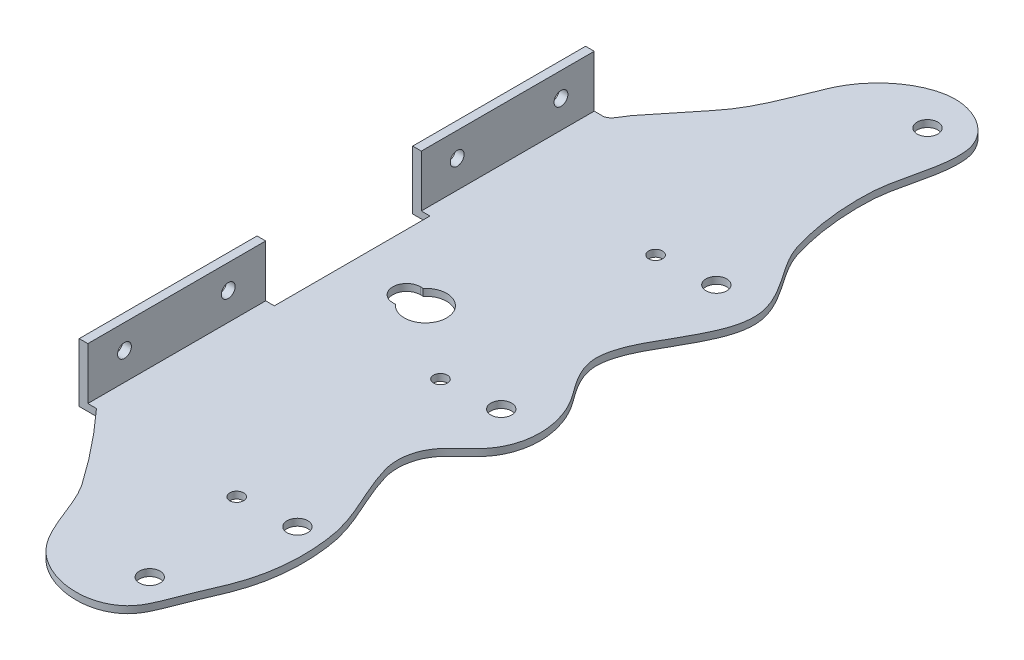
from build123d import *

# Parameters (mm, degrees)
SALIENTE_EXTRUIR1_DEPTH           = 2
CROQUIS2_W                        = 50
CROQUIS2_H                        = 2
SALIENTE_EXTRUIR2_DEPTH           = 5.004813031
CROQUIS3_W                        = 2.502406515
CROQUIS3_H                        = 50
SALIENTE_EXTRUIR3_DEPTH           = 15
CROQUIS4_W                        = 51.418589997
CROQUIS4_H                        = 2
SALIENTE_EXTRUIR4_DEPTH           = 5.004813031
CROQUIS5_W                        = 2.502406515
CROQUIS5_H                        = 51.418589997
SALIENTE_EXTRUIR5_DEPTH           = 15
CORTAR_EXTRUIR1_DEPTH             = 1448.635411368
CORTAR_EXTRUIR2_DEPTH             = 1448.635411368
CORTAR_EXTRUIR3_DEPTH             = 1448.613306186
CROQUIS9_W                        = 6.135874877
CROQUIS9_H                        = 2
DI_METRO_DE_TALADRO_4_0_4_1_D     = 4
DI_METRO_DE_TALADRO_4_0_4_1_DEPTH = 1
DI_METRO_DE_TALADRO_4_0_4_2_D     = 4
DI_METRO_DE_TALADRO_4_0_4_2_DEPTH = 17
DI_METRO_DE_TALADRO_4_0_4_3_D     = 4
TALADRO_DE_MARGEN_PARA_M31_D      = 3.44
SALIENTE_EXTRUIR6_START           = -2
SALIENTE_EXTRUIR6_DEPTH           = 2
CORTAR_EXTRUIR4_START             = -10
CROQUIS24_R                       = 2
CROQUIS24_R_2                     = 3
CORTAR_EXTRUIR4_DEPTH             = 10


with BuildPart() as part:
    # Croquis1 → Saliente-Extruir1 (new body)
    with BuildSketch(Plane.XZ):
        with BuildLine():
            Line((404.298492976, -1165.264323107), (404.298492976, -1311.682913104))
            add(Edge.make_bspline(
                [(404.298492976, -1311.682913104), (406.295600934, -1311.73670596), (407.085011738, -1314.448798712), (409.575192945, -1317.543450583), (410.820283548, -1319.090776518), (414.555555359, -1323.732754325), (417.064874752, -1326.799999334), (424.513235647, -1336.31013242), (426.85319363, -1344.045096647), (433.171429492, -1358.707777505), (440.24638832, -1365.155095367), (456.088524035, -1368.09341803), (464.999916662, -1362.93260796), (466.165817384, -1346.91506331), (462.473581678, -1339.190336571), (461.762695776, -1323.258185102), (462.721630003, -1315.29199423), (467.160419552, -1300.067455881), (474.176253099, -1294.505524425), (477.95492938, -1278.723676971), (472.734514965, -1270.976586072), (465.105690644, -1257.272468378), (463.326944585, -1252.430574254), (464.721292469, -1244.265618359), (467.324164939, -1240.80520417), (474.859619179, -1230.459015573), (476.348995328, -1220.808198324), (469.715777811, -1209.811433239), (465.878031569, -1207.571266654), (460.805018266, -1200.611496491), (460.133507775, -1195.933979545), (463.620047448, -1183.549437586), (468.65431393, -1176.213189786), (471.50483536, -1159.352332822), (471.1045447, -1150.517868538), (466.884735434, -1138.417325687), (465.012012783, -1134.573448161), (461.842122724, -1126.615111069), (460.633411016, -1122.179849781), (450.489854868, -1114.245923823), (439.66007674, -1115.944595274), (427.144129501, -1127.180072345), (426.027987252, -1136.677543953), (421.436838305, -1143.838030063)],
                knots=[0, 0, 0, 0, 0.015625, 0.015625, 0.03125, 0.03125, 0.0625, 0.0625, 0.125, 0.125, 0.1875, 0.1875, 0.25, 0.25, 0.3125, 0.3125, 0.375, 0.375, 0.4375, 0.4375, 0.5, 0.5, 0.53125, 0.53125, 0.5625, 0.5625, 0.625, 0.625, 0.65625, 0.65625, 0.6875, 0.6875, 0.75, 0.75, 0.8125, 0.8125, 0.84375, 0.84375, 0.875, 0.875, 0.9375, 0.9375, 1, 1, 1, 1], degree=3))
            ThreePointArc((421.436838305, -1143.838030063), (413.232276838, -1154.842819783), (404.298492976, -1165.264323107))
        make_face()
    extrude(amount=-SALIENTE_EXTRUIR1_DEPTH)

    # Croquis2 → Saliente-Extruir2 (add)
    with BuildSketch(Plane.ZY.offset(-404.298492976)):
        with Locations((-1286.682913104, 1)):
            Rectangle(CROQUIS2_W, CROQUIS2_H)
    extrude(amount=SALIENTE_EXTRUIR2_DEPTH)

    # Croquis3 → Saliente-Extruir3 (add)
    with BuildSketch(Plane(origin=(0, 2, 0), x_dir=(-1, 0, 0), z_dir=(0, 1, 0))):
        with Locations((-400.544883203, -1286.682913104)):
            Rectangle(CROQUIS3_W, CROQUIS3_H)
    extrude(amount=SALIENTE_EXTRUIR3_DEPTH)

    # Croquis4 → Saliente-Extruir4 (add)
    with BuildSketch(Plane.ZY.offset(-404.298492976)):
        with Locations((-1190.973618106, 1)):
            Rectangle(CROQUIS4_W, CROQUIS4_H)
    extrude(amount=SALIENTE_EXTRUIR4_DEPTH)

    # Croquis5 → Saliente-Extruir5 (add)
    with BuildSketch(Plane(origin=(0, 2, 0), x_dir=(-1, 0, 0), z_dir=(0, 1, 0))):
        with Locations((-400.544883203, -1190.973618106)):
            Rectangle(CROQUIS5_W, CROQUIS5_H)
    extrude(amount=SALIENTE_EXTRUIR5_DEPTH)

    # Croquis6 → Cortar-Extruir1 (cut, through all)
    with BuildSketch(Plane.XZ):
        Polygon((426.266438811, -1295.221200406), (430.289972547, -1290.254724643), (426.106205294, -1275.694136803), (430.239033297, -1263.736681328), (420.807071138, -1267.161830388), (415.401529136, -1278.731968094), (415.401529136, -1299.962609125), (435.828139795, -1316.510994944), align=None)
    extrude(amount=-CORTAR_EXTRUIR1_DEPTH, mode=Mode.SUBTRACT)

    # Croquis7 → Cortar-Extruir2 (cut, through all)
    with BuildSketch(Plane.XZ):
        Polygon((435.478455231, -1159.092892897), (415.401529136, -1176.14507794), (415.401529136, -1194.626217037), (420.318804825, -1205.574874526), (428.972970646, -1207.582067125), (426.106205294, -1197.960443162), (429.363866303, -1183.914786272), (424.645887736, -1178.717195237), align=None)
    extrude(amount=-CORTAR_EXTRUIR2_DEPTH, mode=Mode.SUBTRACT)

    # Croquis8 → Cortar-Extruir3 (cut, through all)
    with BuildSketch(Plane(origin=(0, 2, 0), x_dir=(-1, 0, 0), z_dir=(0, 1, 0))):
        with BuildLine():
            Line((-420.648750921, -1234.586270704), (-421.436838319, -1234.586270704))
            ThreePointArc((-421.436838319, -1234.586270704), (-419.953807788, -1238.586270704), (-421.436838319, -1242.586270704))
            Line((-421.436838319, -1242.586270704), (-420.648750921, -1242.586270704))
            ThreePointArc((-420.648750921, -1242.586270704), (-416.648750921, -1238.586270704), (-420.648750921, -1234.586270704))
        make_face()
    extrude(amount=-CORTAR_EXTRUIR3_DEPTH, mode=Mode.SUBTRACT)

    # Croquis9 → Cortar-Revolución1 (revolve, cut)
    with BuildSketch(Plane.XY.offset(-1238.586270704)):
        with Locations((429.157620104, 1)):
            Rectangle(CROQUIS9_W, CROQUIS9_H)
    revolve(axis=Axis((426.089682665, 2, -1238.586270704), (0, -1, 0)), mode=Mode.SUBTRACT)

    # Diámetro de taladro Ø4.0 (4)1
    with Locations(Plane(origin=(0, 2, 0), x_dir=(1, 0, 0), z_dir=(0, 1, 0))):
        with Locations((446.659713553, 1222.361997103), (446.659713553, 1284.557247673), (446.659713553, 1163.426981441)):
            Hole(DI_METRO_DE_TALADRO_4_0_4_1_D / 2, depth=DI_METRO_DE_TALADRO_4_0_4_1_DEPTH)

    # Diámetro de taladro Ø4.0 (4)2
    with Locations(Plane(origin=(0, 0, 0), x_dir=(-1, 0, 0), z_dir=(0, -1, 0))):
        with Locations((-462.939861939, 1223.64910089), (-454.197507278, 1130.757409511), (-462.939861939, 1285.84435146), (-462.939861939, 1164.714085229), (-454.197507278, 1355.629100891)):
            Hole(DI_METRO_DE_TALADRO_4_0_4_2_D / 2, depth=DI_METRO_DE_TALADRO_4_0_4_2_DEPTH)

    # Diámetro de taladro Ø4.0 (4)3 (through all)
    with Locations(Plane(origin=(401.79608646, 0, 0), x_dir=(0, 0, -1), z_dir=(1, 0, 0))):
        with Locations((1272.055834047, 10), (1302.055834047, 10), (1175.855834047, 10), (1205.855834047, 10)):
            Hole(DI_METRO_DE_TALADRO_4_0_4_3_D / 2)

    # Taladro de margen para M31 (through all)
    with Locations(Plane(origin=(0, 2, 0), x_dir=(1, 0, 0), z_dir=(0, 1, 0))):
        with Locations((419.222220334, 1220.98018858), (420.318804825, 1227.819651115), (419.222220334, 1256.192352828), (420.318804825, 1249.352890293), (426.716128605, 1252.528364662), (426.716128605, 1224.644176746)):
            Hole(TALADRO_DE_MARGEN_PARA_M31_D / 2)

    # Croquis18 → Saliente-Extruir6 (add)
    with BuildSketch(Plane(origin=(0, 2, 0), x_dir=(-1, 0, 0), z_dir=(0, 1, 0)).offset(SALIENTE_EXTRUIR6_START)):
        Polygon((-435.478455231, -1159.092892897), (-415.401529136, -1176.14507794), (-415.401529136, -1194.626217037), (-420.318804825, -1205.574874526), (-428.972970646, -1207.582067125), (-426.106205294, -1197.960443162), (-429.363866303, -1183.914786272), (-424.645887736, -1178.717195237), align=None)
        Polygon((-415.401529136, -1299.962609125), (-415.401529136, -1278.731968094), (-420.807071138, -1267.161830388), (-430.239033297, -1263.736681328), (-426.106205294, -1275.694136803), (-430.289972547, -1290.254724643), (-426.266438811, -1295.221200406), (-435.828139795, -1316.510994944), align=None)
        with BuildLine():
            ThreePointArc((-419.222220334, -1222.70018858), (-417.502220334, -1220.98018858), (-419.222220334, -1219.26018858))
            ThreePointArc((-419.222220334, -1219.26018858), (-420.942220334, -1220.98018858), (-419.222220334, -1222.70018858))
        make_face()
        with BuildLine():
            ThreePointArc((-426.716128605, -1222.924176746), (-428.436128605, -1224.644176746), (-426.716128605, -1226.364176746))
            ThreePointArc((-426.716128605, -1226.364176746), (-424.996128605, -1224.644176746), (-426.716128605, -1222.924176746))
        make_face()
        with BuildLine():
            ThreePointArc((-420.318804825, -1229.539651115), (-418.598804825, -1227.819651115), (-420.318804825, -1226.099651115))
            ThreePointArc((-420.318804825, -1226.099651115), (-422.038804825, -1227.819651115), (-420.318804825, -1229.539651115))
        make_face()
        with BuildLine():
            ThreePointArc((-420.318804825, -1247.632890293), (-422.038804825, -1249.352890293), (-420.318804825, -1251.072890293))
            ThreePointArc((-420.318804825, -1251.072890293), (-418.598804825, -1249.352890293), (-420.318804825, -1247.632890293))
        make_face()
        with BuildLine():
            ThreePointArc((-419.222220334, -1257.912352828), (-417.502220334, -1256.192352828), (-419.222220334, -1254.472352828))
            ThreePointArc((-419.222220334, -1254.472352828), (-420.942220334, -1256.192352828), (-419.222220334, -1257.912352828))
        make_face()
        with BuildLine():
            ThreePointArc((-426.716128605, -1250.808364662), (-428.436128605, -1252.528364662), (-426.716128605, -1254.248364662))
            ThreePointArc((-426.716128605, -1254.248364662), (-424.996128605, -1252.528364662), (-426.716128605, -1250.808364662))
        make_face()
    extrude(amount=SALIENTE_EXTRUIR6_DEPTH)

    # Croquis24 → Cortar-Extruir4 (cut)
    with BuildSketch(Plane(origin=(0, 2, 0), x_dir=(1, 0, 0), z_dir=(0, 1, 0)).offset(CORTAR_EXTRUIR4_START)):
        with Locations(Location((446.659713553, 1284.557247673, 0), (0, 0, 270))):
            Circle(CROQUIS24_R)
        with Locations(Location((446.659713553, 1222.361997103, 0), (0, 0, 270))):
            Circle(CROQUIS24_R)
        with Locations(Location((446.659713553, 1163.426981441, 0), (0, 0, 270))):
            Circle(CROQUIS24_R)
        with Locations(Location((454.197507278, 1130.757409511, 0), (0, 0, 270))):
            Circle(CROQUIS24_R_2)
        with Locations(Location((462.939861939, 1164.714085229, 0), (0, 0, 270))):
            Circle(CROQUIS24_R_2)
        with Locations(Location((462.939861939, 1223.64910089, 0), (0, 0, 270))):
            Circle(CROQUIS24_R_2)
        with Locations(Location((462.939861939, 1285.84435146, 0), (0, 0, 270))):
            Circle(CROQUIS24_R_2)
        with Locations(Location((454.197507278, 1355.629100891, 0), (0, 0, 270))):
            Circle(CROQUIS24_R_2)
    extrude(amount=CORTAR_EXTRUIR4_DEPTH, mode=Mode.SUBTRACT)


solid = part.part
